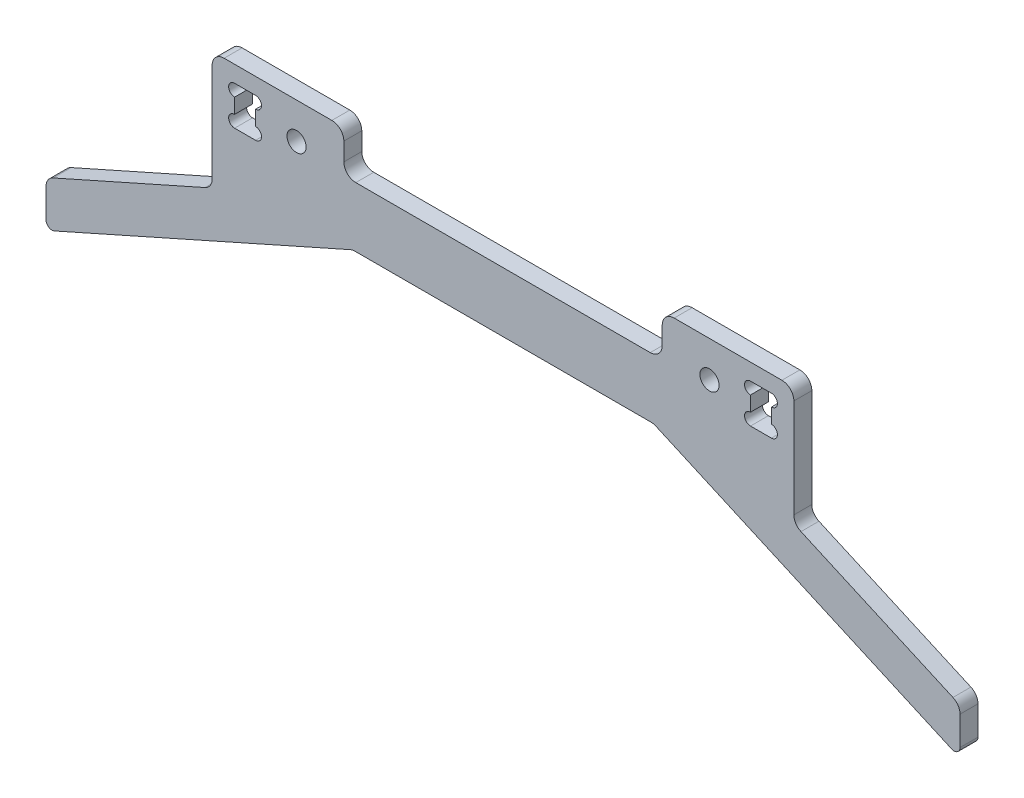
from build123d import *

# Parameters (mm, degrees)
EXTRUDE_1_DEPTH     = 3
SKETCH_2_W          = 83.2
SKETCH_2_H          = 9
EXTRUDE_2_DEPTH     = 3
SKETCH_3_W          = 42.77133807
SKETCH_3_H          = 9.521513309
CUT_EXTRUDE_1_DEPTH = 3
EXTRUDE_3_DEPTH     = 3
CUT_EXTRUDE_2_DEPTH = 3
EXTRUDE_4_DEPTH     = 3
SKETCH_6_R          = 1.6
CUT_EXTRUDE_3_DEPTH = 3
SKETCH_8_W          = 53.2
SKETCH_8_H          = 7
CUT_EXTRUDE_4_DEPTH = 10
FILLET_2_R          = 2
FILLET_3_R          = 1


with BuildPart() as part:
    # 草图1 → 凸台-拉伸1 (new body)
    with BuildSketch(Plane.XY):
        Polygon((76.365250313, 0), (0, 34), (-76.365250313, 0), (-76.365250313, 6.567817671), (0, 40.567817671), (76.365250313, 6.567817671), align=None)
    extrude(amount=EXTRUDE_1_DEPTH)

    # 草图2 → 凸台-拉伸2 (add)
    with BuildSketch(Plane.XY.offset(3)):
        with Locations((0, 26.546304362)):
            Rectangle(SKETCH_2_W, SKETCH_2_H)
    extrude(amount=-EXTRUDE_2_DEPTH)

    # 草图3 → 切除-拉伸1 (cut)
    with BuildSketch(Plane.XY.offset(3)):
        with Locations((0, 35.807061017)):
            Rectangle(SKETCH_3_W, SKETCH_3_H)
    extrude(amount=-CUT_EXTRUDE_1_DEPTH, mode=Mode.SUBTRACT)

    # 草图4 → 凸台-拉伸3 (add)
    with BuildSketch(Plane.XY.offset(3)):
        Polygon((41.6, 31.046304362), (48.6, 31.046304362), (48.6, 18.929703565), (41.6, 22.046304362), align=None)
        Polygon((-41.6, 31.046304362), (-48.6, 31.046304362), (-48.6, 18.929703565), (-41.6, 22.046304362), align=None)
    extrude(amount=-EXTRUDE_3_DEPTH)

    # 草图5 → 切除-拉伸2 (cut)
    with BuildSketch(Plane.XY.offset(3)):
        with BuildLine():
            Line((-44.85, 28.296304362), (-41.35, 28.296304362))
            ThreePointArc((-41.35, 28.296304362), (-40.35, 27.296304362), (-41.35, 26.296304362))
            Line((-41.35, 26.296304362), (-41.35, 23.796304362))
            ThreePointArc((-41.35, 23.796304362), (-40.35, 22.796304362), (-41.35, 21.796304362))
            Line((-41.35, 21.796304362), (-44.85, 21.796304362))
            ThreePointArc((-44.85, 21.796304362), (-45.85, 22.796304362), (-44.85, 23.796304362))
            Line((-44.85, 23.796304362), (-44.85, 26.296304362))
            ThreePointArc((-44.85, 26.296304362), (-45.85, 27.296304362), (-44.85, 28.296304362))
        make_face()
        with BuildLine():
            Line((41.35, 26.296304362), (41.35, 23.796304362))
            ThreePointArc((41.35, 23.796304362), (40.35, 22.796304362), (41.35, 21.796304362))
            Line((41.35, 21.796304362), (44.85, 21.796304362))
            ThreePointArc((44.85, 21.796304362), (45.85, 22.796304362), (44.85, 23.796304362))
            Line((44.85, 23.796304362), (44.85, 26.296304362))
            ThreePointArc((44.85, 26.296304362), (45.85, 27.296304362), (44.85, 28.296304362))
            Line((44.85, 28.296304362), (41.35, 28.296304362))
            ThreePointArc((41.35, 28.296304362), (40.35, 27.296304362), (41.35, 26.296304362))
        make_face()
    extrude(amount=-CUT_EXTRUDE_2_DEPTH, mode=Mode.SUBTRACT)

    # 草图7 → 凸台-拉伸4 (add)
    with BuildSketch(Plane.XY.offset(3)):
        Polygon((26.848439987, 22.046304362), (76.365250313, 0), (76.365250313, -8.757090228), (25.147987493, 14.046304362), (-25.147987493, 14.046304362), (-76.365250313, -8.757090228), (-76.365250313, 0), (-26.848439987, 22.046304362), align=None)
    extrude(amount=-EXTRUDE_4_DEPTH)

    # 草图6 → 切除-拉伸3 (cut)
    with BuildSketch(Plane(origin=(0, 0, 0), x_dir=(-1, 0, 0), z_dir=(0, 0, -1))):
        with Locations((-34.5, 25.046304362)):
            Circle(SKETCH_6_R)
        with Locations(Location((34.5, 25.046304362, 0), (0, 0, 180))):
            Circle(SKETCH_6_R)
    extrude(amount=-CUT_EXTRUDE_3_DEPTH, mode=Mode.SUBTRACT)

    # 草图8 → 切除-拉伸4 (cut)
    with BuildSketch(Plane.XY.offset(3)):
        Polygon((-76.365250313, -1.094636279), (-48.6, 11.267249615), (-48.6, 18.929703565), (-76.365250313, 6.567817671), align=None)
        with Locations((0, 27.546304362)):
            Rectangle(SKETCH_8_W, SKETCH_8_H)
        Polygon((48.6, 18.929703565), (76.365250313, 6.567817671), (76.365250313, -1.094636279), (48.6, 11.267249615), align=None)
    extrude(amount=-CUT_EXTRUDE_4_DEPTH, mode=Mode.SUBTRACT)

    # 圆角2
    fillet_2_edges = [part.edges().sort_by_distance(p)[0] for p in [
        (25.147987493, 14.046304362, 1.5),
        (-25.147987493, 14.046304362, 1.5),
        (-26.6, 31.046304362, 1.5),
        (26.6, 31.046304362, 1.5),
        (-76.365250313, -1.094636279, 1.5),
        (-48.6, 11.267249615, 1.5),
        (26.6, 24.046304362, 1.5),
        (-26.6, 24.046304362, 1.5),
        (48.6, 11.267249615, 1.5),
        (76.365250313, -1.094636279, 1.5),
        (48.6, 31.046304362, 1.5),
        (-48.6, 31.046304362, 1.5),
    ]]
    fillet(fillet_2_edges, radius=FILLET_2_R)

    # 圆角3
    fillet_3_edges = [part.edges().sort_by_distance(p)[0] for p in [
        (76.365250313, -8.757090228, 1.5),
        (-76.365250313, -8.757090228, 1.5),
    ]]
    fillet(fillet_3_edges, radius=FILLET_3_R)


solid = part.part
